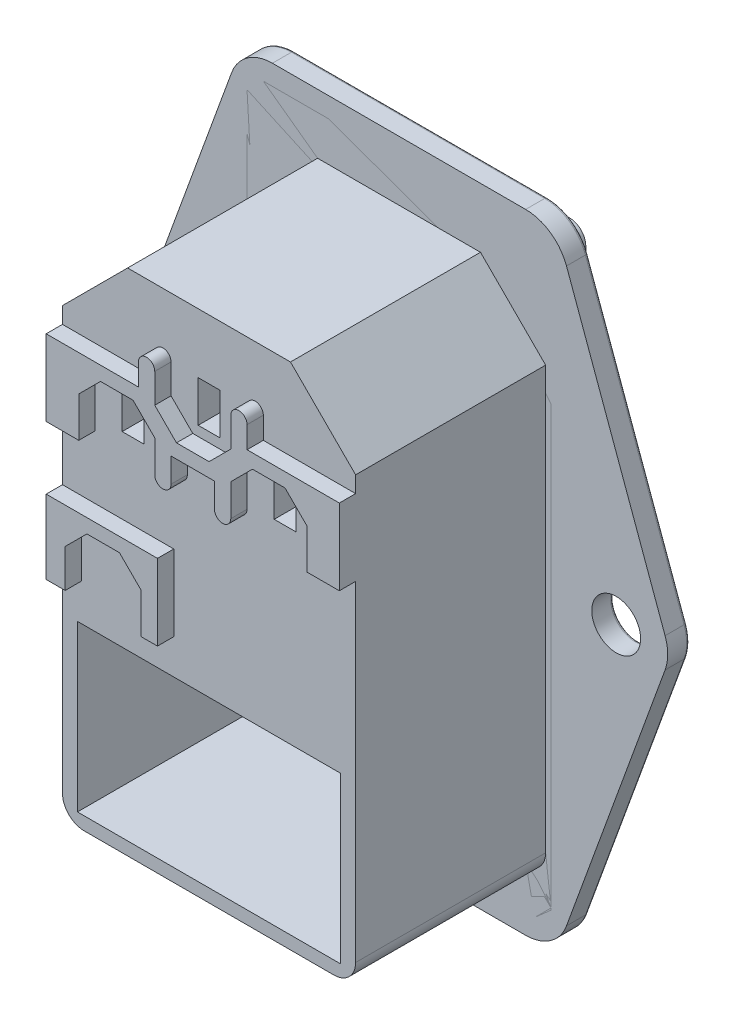
from build123d import *

# Parameters (mm, degrees)
BASE_EXTRUDE_DEPTH                  = 17.5
SKETCH2_W                           = 24.24
SKETCH2_H                           = 15.2
SWITCH_CAVITY_DEPTH                 = 17.5
MOUNTING_FACE_EXTRUDE_DEPTH         = 2
FRONT_FACE_DEPTH                    = 1.2
FRONT_FACE_DEPTH_BACK               = 2
SKETCH8_W                           = 2.25
SKETCH8_H                           = 19.5
F_4_5_4_5_DIAMETER_HOLE1_AT_2_COUNT = 2
F_4_5_4_5_DIAMETER_HOLE1_AT_2_PITCH = 40
SKETCH9_W                           = 25
SKETCH9_H                           = 9
FUSE_SLOT_CUT_DEPTH                 = 18
CUT_EXTRUDE3_DEPTH                  = 2.25
SKETCH11_W                          = 19
SKETCH11_H                          = 13.2
CUT_EXTRUDE4_DEPTH                  = 18.45
CUT_EXTRUDE6_DEPTH                  = 19.35
BOSS_EXTRUDE6_DEPTH                 = 2.75
BOSS_EXTRUDE7_DEPTH                 = 2.75
SKETCH18_W                          = 2
SKETCH18_H                          = 3.8
CUT_EXTRUDE7_DEPTH                  = 4.1
SKETCH19_W                          = 2
SKETCH19_H                          = 6
CUT_EXTRUDE8_DEPTH                  = 1.5
SKETCH21_W                          = 4.16
SKETCH21_H                          = 2
CUT_EXTRUDE10_DEPTH                 = 18
BOSS_EXTRUDE10_DEPTH                = 1.5
MOUNTING_FACE_FILLETS_R             = 0.25


with BuildPart() as part:
    # Sketch1 → Base Extrude (new body)
    with BuildSketch(Plane.XY):
        with BuildLine():
            Line((-13.5, 17.45), (-7.5, 23.45))
            Line((-7.5, 23.45), (7.5, 23.45))
            Line((7.5, 23.45), (13.5, 17.45))
            Line((13.5, 17.45), (13.5, -21.45))
            ThreePointArc((13.5, -21.45), (12.914213562, -22.864213562), (11.5, -23.45))
            Line((11.5, -23.45), (-11.5, -23.45))
            ThreePointArc((-11.5, -23.45), (-12.914213562, -22.864213562), (-13.5, -21.45))
            Line((-13.5, -21.45), (-13.5, 17.45))
        make_face()
    extrude(amount=BASE_EXTRUDE_DEPTH)

    # Sketch2 → Switch Cavity (cut)
    with BuildSketch(Plane(origin=(0, 0, 0), x_dir=(-1, 0, 0), z_dir=(0, 0, -1))):
        with Locations((0, -14.65)):
            Rectangle(SKETCH2_W, SKETCH2_H)
    extrude(amount=-SWITCH_CAVITY_DEPTH, mode=Mode.SUBTRACT)

    # Sketch4 → Front Face (add, two sides: drawn at the far end of the back side and taken through both)
    with BuildSketch(Plane(origin=(0, 0, -2), x_dir=(-1, 0, 0), z_dir=(0, 0, -1)).offset(-FRONT_FACE_DEPTH_BACK)):
        with BuildLine():
            Line((-12.5, 27.1), (12.5, 27.1))
            ThreePointArc((12.5, 27.1), (13.560660172, 26.660660172), (14, 25.6))
            Line((14, 25.6), (14, -25.6))
            ThreePointArc((14, -25.6), (13.560660172, -26.660660172), (12.5, -27.1))
            Line((12.5, -27.1), (-12.5, -27.1))
            ThreePointArc((-12.5, -27.1), (-13.560660172, -26.660660172), (-14, -25.6))
            Line((-14, -25.6), (-14, 25.6))
            ThreePointArc((-14, 25.6), (-13.560660172, 26.660660172), (-12.5, 27.1))
        make_face()
    extrude(amount=FRONT_FACE_DEPTH + FRONT_FACE_DEPTH_BACK)


with BuildPart() as body_2:
    # Sketch3 → Mounting Face Extrude (new body)
    with BuildSketch(Plane(origin=(0, 0, 0), x_dir=(-1, 0, 0), z_dir=(0, 0, -1))):
        with BuildLine():
            Line((-11.662231565, 28.95), (11.662231565, 28.95))
            ThreePointArc((11.662231565, 28.95), (13.956537311, 28.226608177), (15.421002048, 26.318080573))
            Line((15.421002048, 26.318080573), (24.502059393, 1.368080573))
            ThreePointArc((24.502059393, 1.368080573), (24.74328891, 0), (24.502059393, -1.368080573))
            Line((24.502059393, -1.368080573), (15.421002048, -26.318080573))
            ThreePointArc((15.421002048, -26.318080573), (13.956537311, -28.226608177), (11.662231565, -28.95))
            Line((11.662231565, -28.95), (-11.662231565, -28.95))
            ThreePointArc((-11.662231565, -28.95), (-13.956537311, -28.226608177), (-15.421002048, -26.318080573))
            Line((-15.421002048, -26.318080573), (-24.502059393, -1.368080573))
            ThreePointArc((-24.502059393, -1.368080573), (-24.74328891, 0), (-24.502059393, 1.368080573))
            Line((-24.502059393, 1.368080573), (-15.421002048, 26.318080573))
            ThreePointArc((-15.421002048, 26.318080573), (-13.956537311, 28.226608177), (-11.662231565, 28.95))
        make_face()
    extrude(amount=MOUNTING_FACE_EXTRUDE_DEPTH)

    # Sketch8 → Ø4.5 (4.5) Diameter Hole1 (revolve, cut)
    with BuildSketch(Plane(origin=(20, 0, -2), x_dir=(0, 1, 0), z_dir=(1, 0, 0))):
        with Locations((1.125, 9.75)):
            Rectangle(SKETCH8_W, SKETCH8_H)
    f_4_5_4_5_diameter_hole1 = revolve(axis=Axis((20, 0, -8.35), (0, 0, 1)), mode=Mode.SUBTRACT)

    # Ø4.5 (4.5) Diameter Hole1 at 2: Ø4.5 (4.5) Diameter Hole1 ×2
    with Locations(*[(-i * F_4_5_4_5_DIAMETER_HOLE1_AT_2_PITCH, 0, 0) for i in range(1, F_4_5_4_5_DIAMETER_HOLE1_AT_2_COUNT)]):
        add(f_4_5_4_5_diameter_hole1, mode=Mode.SUBTRACT)


with BuildPart() as fuse_slot_cut_tool:
    # Sketch9 → Fuse Slot Cut (new body)
    with BuildSketch(Plane(origin=(0, 0, -3.2), x_dir=(-1, 0, 0), z_dir=(0, 0, -1))):
        with Locations((0, -0.45)):
            Rectangle(SKETCH9_W, SKETCH9_H)
    extrude(amount=-FUSE_SLOT_CUT_DEPTH)


with BuildPart() as part_1:
    add(part.part)

    # Fuse Slot Cut: cut by fuse_slot_cut_tool
    add(fuse_slot_cut_tool.part, mode=Mode.SUBTRACT)


with BuildPart() as body_2_1:
    add(body_2.part)

    # Fuse Slot Cut: cut by fuse_slot_cut_tool
    add(fuse_slot_cut_tool.part, mode=Mode.SUBTRACT)


with BuildPart() as cut_extrude3_tool:
    # Sketch10 → Cut-Extrude3 (new body)
    with BuildSketch(Plane(origin=(0, 0, -3.2), x_dir=(-1, 0, 0), z_dir=(0, 0, -1))):
        with BuildLine():
            Line((-9.65, -7.05), (9.65, -7.05))
            ThreePointArc((9.65, -7.05), (10.357106781, -7.342893219), (10.65, -8.05))
            Line((10.65, -8.05), (10.65, -21.35))
            ThreePointArc((10.65, -21.35), (10.357106781, -22.057106781), (9.65, -22.35))
            Line((9.65, -22.35), (-9.65, -22.35))
            ThreePointArc((-9.65, -22.35), (-10.357106781, -22.057106781), (-10.65, -21.35))
            Line((-10.65, -21.35), (-10.65, -8.05))
            ThreePointArc((-10.65, -8.05), (-10.357106781, -7.342893219), (-9.65, -7.05))
        make_face()
    extrude(amount=-CUT_EXTRUDE3_DEPTH)


with BuildPart() as part_2:
    add(part_1.part)

    # Cut-Extrude3: cut by cut_extrude3_tool
    add(cut_extrude3_tool.part, mode=Mode.SUBTRACT)


with BuildPart() as body_2_2:
    add(body_2_1.part)

    # Cut-Extrude3: cut by cut_extrude3_tool
    add(cut_extrude3_tool.part, mode=Mode.SUBTRACT)


with BuildPart() as cut_extrude4_tool:
    # Sketch11 → Cut-Extrude4 (new body)
    with BuildSketch(Plane(origin=(0, 0, -0.95), x_dir=(-1, 0, 0), z_dir=(0, 0, -1))):
        with Locations((0, -14.65)):
            Rectangle(SKETCH11_W, SKETCH11_H)
    extrude(amount=-CUT_EXTRUDE4_DEPTH)


with BuildPart() as part_3:
    add(part_2.part)

    # Cut-Extrude4: cut by cut_extrude4_tool
    add(cut_extrude4_tool.part, mode=Mode.SUBTRACT)


with BuildPart() as body_2_3:
    add(body_2_2.part)

    # Cut-Extrude4: cut by cut_extrude4_tool
    add(cut_extrude4_tool.part, mode=Mode.SUBTRACT)


with BuildPart() as cut_extrude6_tool:
    # Sketch12 → Cut-Extrude6 (new body)
    with BuildSketch(Plane(origin=(0, 0, -3.2), x_dir=(-1, 0, 0), z_dir=(0, 0, -1))):
        with BuildLine():
            Line((-6.7, 22.35), (6.7, 22.35))
            Line((6.7, 22.35), (12.2, 16.85))
            Line((12.2, 16.85), (12.2, 8.55))
            ThreePointArc((12.2, 8.55), (11.467766953, 6.782233047), (9.7, 6.05))
            Line((9.7, 6.05), (-9.7, 6.05))
            ThreePointArc((-9.7, 6.05), (-11.467766953, 6.782233047), (-12.2, 8.55))
            Line((-12.2, 8.55), (-12.2, 16.85))
            Line((-12.2, 16.85), (-6.7, 22.35))
        make_face()
    extrude(amount=-CUT_EXTRUDE6_DEPTH)


with BuildPart() as part_4:
    add(part_3.part)

    # Cut-Extrude6: cut by cut_extrude6_tool
    add(cut_extrude6_tool.part, mode=Mode.SUBTRACT)

    # Sketch14 → Boss-Extrude6 (add)
    with BuildSketch(Plane(origin=(0, 0, 16.15), x_dir=(-1, 0, 0), z_dir=(0, 0, -1))):
        with BuildLine():
            Line((-6.7, 22.35), (-4.7, 22.35))
            Line((-4.7, 22.35), (-4.7, 19.85))
            ThreePointArc((-4.7, 19.85), (-5.7, 18.85), (-6.7, 19.85))
            Line((-6.7, 19.85), (-6.7, 22.35))
        make_face()
        with BuildLine():
            Line((4.7, 22.35), (4.7, 19.85))
            ThreePointArc((4.7, 19.85), (5.7, 18.85), (6.7, 19.85))
            Line((6.7, 19.85), (6.7, 22.35))
            Line((6.7, 22.35), (4.7, 22.35))
        make_face()
    extrude(amount=BOSS_EXTRUDE6_DEPTH)

    # Sketch16 → Boss-Extrude7 (add)
    with BuildSketch(Plane.XY.offset(16.15)):
        with BuildLine():
            Line((2.5, 18.55), (2.5, 13.55))
            ThreePointArc((2.5, 13.55), (2.353553391, 13.196446609), (2, 13.05))
            Line((2, 13.05), (-2, 13.05))
            ThreePointArc((-2, 13.05), (-2.353553391, 13.196446609), (-2.5, 13.55))
            Line((-2.5, 13.55), (-2.5, 18.55))
            ThreePointArc((-2.5, 18.55), (-2.353553391, 18.903553391), (-2, 19.05))
            Line((-2, 19.05), (2, 19.05))
            ThreePointArc((2, 19.05), (2.353553391, 18.903553391), (2.5, 18.55))
        make_face()
        with BuildLine():
            Line((9, 15.05), (5, 15.05))
            ThreePointArc((5, 15.05), (4.646446609, 14.903553391), (4.5, 14.55))
            Line((4.5, 14.55), (4.5, 9.55))
            ThreePointArc((4.5, 9.55), (4.646446609, 9.196446609), (5, 9.05))
            Line((5, 9.05), (9, 9.05))
            ThreePointArc((9, 9.05), (9.353553391, 9.196446609), (9.5, 9.55))
            Line((9.5, 9.55), (9.5, 14.55))
            ThreePointArc((9.5, 14.55), (9.353553391, 14.903553391), (9, 15.05))
        make_face()
        with BuildLine():
            Line((-4.5, 14.55), (-4.5, 9.55))
            ThreePointArc((-4.5, 9.55), (-4.646446609, 9.196446609), (-5, 9.05))
            Line((-5, 9.05), (-9, 9.05))
            ThreePointArc((-9, 9.05), (-9.353553391, 9.196446609), (-9.5, 9.55))
            Line((-9.5, 9.55), (-9.5, 14.55))
            ThreePointArc((-9.5, 14.55), (-9.353553391, 14.903553391), (-9, 15.05))
            Line((-9, 15.05), (-5, 15.05))
            ThreePointArc((-5, 15.05), (-4.646446609, 14.903553391), (-4.5, 14.55))
        make_face()
    extrude(amount=-BOSS_EXTRUDE7_DEPTH)

    # Sketch18 → Cut-Extrude7 (cut)
    with BuildSketch(Plane(origin=(0, 0, 13.4), x_dir=(-1, 0, 0), z_dir=(0, 0, -1))):
        with Locations((-7, 12.05)):
            Rectangle(SKETCH18_W, SKETCH18_H)
        with Locations((7, 12.05)):
            Rectangle(SKETCH18_W, SKETCH18_H)
        with Locations((0, 16.05)):
            Rectangle(SKETCH18_W, SKETCH18_H)
    extrude(amount=-CUT_EXTRUDE7_DEPTH, mode=Mode.SUBTRACT)

    # Sketch19 → Cut-Extrude8 (cut)
    with BuildSketch(Plane(origin=(0, 0, 13.4), x_dir=(-1, 0, 0), z_dir=(0, 0, -1))):
        with Locations((-7, 12.05)):
            Rectangle(SKETCH19_W, SKETCH19_H)
        with Locations((0, 16.05)):
            Rectangle(SKETCH19_W, SKETCH19_H)
        with Locations((7, 12.05)):
            Rectangle(SKETCH19_W, SKETCH19_H)
    extrude(amount=-CUT_EXTRUDE8_DEPTH, mode=Mode.SUBTRACT)

    # Sketch21 → Cut-Extrude10 (cut)
    with BuildSketch(Plane(origin=(0, 0, -3.2), x_dir=(-1, 0, 0), z_dir=(0, 0, -1))):
        with Locations((0, 5.05)):
            Rectangle(SKETCH21_W, SKETCH21_H)
    extrude(amount=-CUT_EXTRUDE10_DEPTH, mode=Mode.SUBTRACT)

    # Sketch22 → Boss-Extrude10 (add)
    with BuildSketch(Plane.XY.offset(17.5)):
        Polygon((-3.25, 3.162016373), (-13.5, 3.162016373), (-13.5, -3.65), (-11.75, -3.65), (-11.75, -0.137983627), (-9.75, 1.862016373), (-6.75, 1.862016373), (-4.75, -0.137983627), (-4.75, -0.837983627), (-4.75, -3.837983627), (-3.25, -3.837983627), align=None)
        with BuildLine():
            Line((13.5, 15.95), (5, 15.95))
            Line((5, 15.95), (5, 17.95))
            ThreePointArc((5, 17.95), (4.25, 18.7), (3.5, 17.95))
            Line((3.5, 17.95), (3.5, 15.25))
            Line((3.5, 15.25), (1.5, 13.25))
            Line((1.5, 13.25), (-1.5, 13.25))
            Line((-1.5, 13.25), (-3.5, 15.25))
            Line((-3.5, 15.25), (-3.5, 15.95))
            Line((-3.5, 15.95), (-3.5, 17.95))
            ThreePointArc((-3.5, 17.95), (-4.25, 18.7), (-5, 17.95))
            Line((-5, 17.95), (-5, 15.95))
            Line((-5, 15.95), (-13.5, 15.95))
            Line((-13.5, 15.95), (-13.5, 8.95))
            Line((-13.5, 8.95), (-10.5, 8.95))
            Line((-10.5, 8.95), (-10.5, 12.65))
            Line((-10.5, 12.65), (-8.5, 14.65))
            Line((-8.5, 14.65), (-5.5, 14.65))
            Line((-5.5, 14.65), (-3.5, 12.65))
            Line((-3.5, 12.65), (-3.5, 11.95))
            Line((-3.5, 11.95), (-3.5, 9.7))
            ThreePointArc((-3.5, 9.7), (-2.75, 8.95), (-2, 9.7))
            Line((-2, 9.7), (-2, 11.95))
            Line((-2, 11.95), (2, 11.95))
            Line((2, 11.95), (2, 9.7))
            ThreePointArc((2, 9.7), (2.75, 8.95), (3.5, 9.7))
            Line((3.5, 9.7), (3.5, 11.95))
            Line((3.5, 11.95), (3.5, 12.65))
            Line((3.5, 12.65), (5.5, 14.65))
            Line((5.5, 14.65), (8.5, 14.65))
            Line((8.5, 14.65), (10.5, 12.65))
            Line((10.5, 12.65), (10.5, 8.95))
            Line((10.5, 8.95), (13.5, 8.95))
            Line((13.5, 8.95), (13.5, 15.95))
        make_face()
    extrude(amount=BOSS_EXTRUDE10_DEPTH)


with BuildPart() as body_2_4:
    add(body_2_3.part)

    # Cut-Extrude6: cut by cut_extrude6_tool
    add(cut_extrude6_tool.part, mode=Mode.SUBTRACT)

    # Mounting Face Fillets
    mounting_face_fillets_edges = [body_2_4.edges().sort_by_distance(p)[0] for p in [
        (-13.956537311, 28.226608177, -2),
        (-9.45, 19.6, -2),
        (-12.2, 12.7, -2),
        (-11.467766953, 6.782233047, -2),
        (0, 6.05, -2),
        (11.467766953, 6.782233047, -2),
        (12.2, 12.7, -2),
        (0, 28.95, -2),
        (9.45, 19.6, -2),
        (0, 22.35, -2),
        (13.956537311, 28.226608177, -2),
        (19.961530721, 13.843080573, -2),
        (24.74328891, 0, -2),
        (19.961530721, -13.843080573, -2),
        (13.956537311, -28.226608177, -2),
        (0, -28.95, -2),
        (-13.956537311, -28.226608177, -2),
        (-19.961530721, -13.843080573, -2),
        (-20, -2.25, -2),
        (-24.74328891, 0, -2),
        (20, -2.25, -2),
        (12.5, -0.45, -2),
        (0, 4.05, -2),
        (-12.5, -0.45, -2),
        (0, -4.95, -2),
        (-19.961530721, 13.843080573, -2),
        (0, -7.05, -2),
        (10.357106781, -7.342893219, -2),
        (10.65, -14.7, -2),
        (10.357106781, -22.057106781, -2),
        (0, -22.35, -2),
        (-10.357106781, -22.057106781, -2),
        (-10.65, -14.7, -2),
        (-10.357106781, -7.342893219, -2),
    ]]
    fillet(mounting_face_fillets_edges, radius=MOUNTING_FACE_FILLETS_R)


solid = Compound([part_4.part, body_2_4.part])
